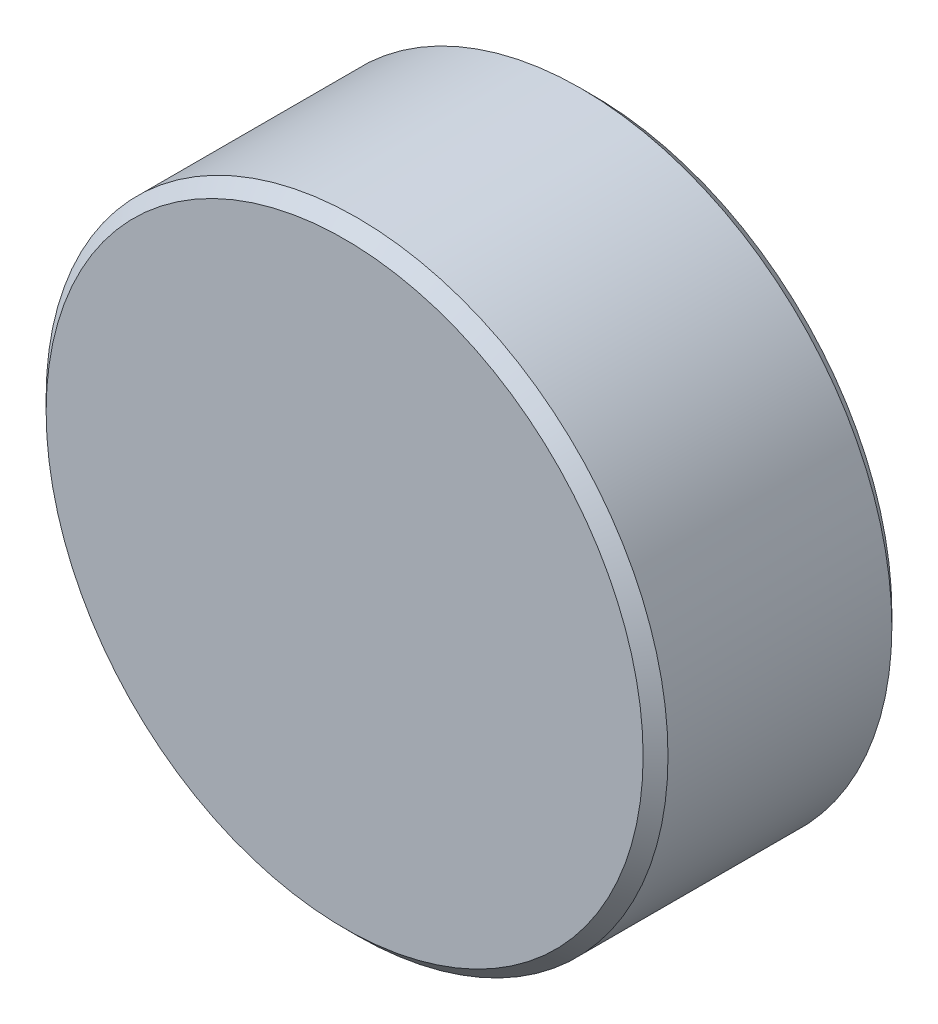
from build123d import *

# Parameters (mm, degrees)
SKETCH1_R           = 3.175
BOSS_EXTRUDE1_DEPTH = 2.54
CHAMFER1_SIZE       = 0.127


with BuildPart() as part:
    # Sketch1 → Boss-Extrude1 (new body)
    with BuildSketch(Plane.XY):
        Circle(SKETCH1_R)
    extrude(amount=BOSS_EXTRUDE1_DEPTH)

    # Chamfer1
    chamfer1_edges = [part.edges().sort_by_distance(p)[0] for p in [
        (-3.175, 0, 0),
        (-3.175, 0, 2.54),
    ]]
    chamfer(chamfer1_edges, length=CHAMFER1_SIZE)


solid = part.part
